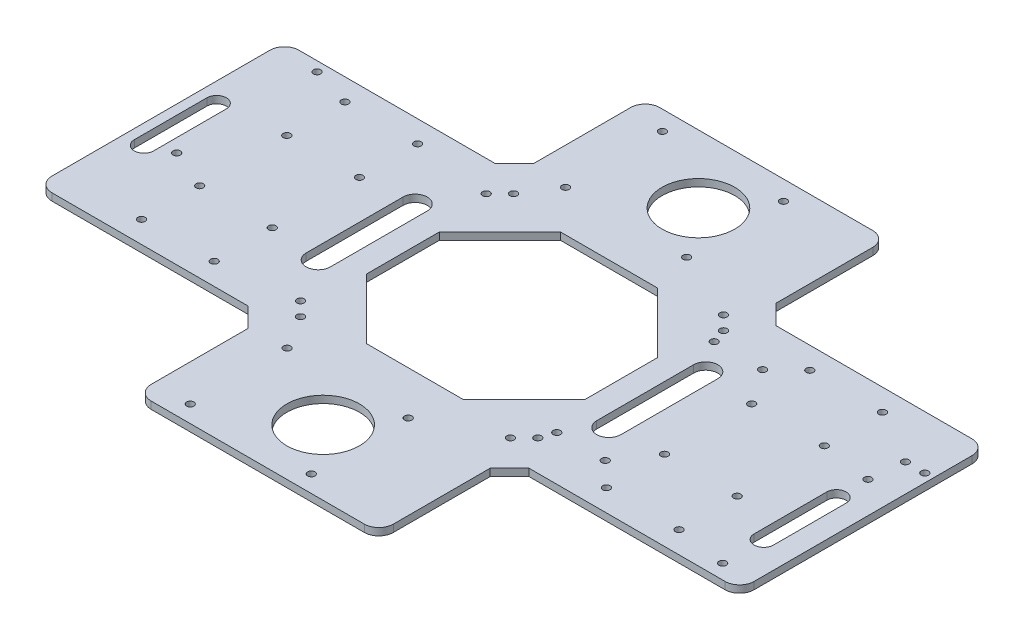
from build123d import *

# Parameters (mm, degrees)
EXTRUDE_1_DEPTH     = 3
SKETCH_2_R          = 1.5
CUT_EXTRUDE_1_DEPTH = 3
SKETCH_3_R          = 15
SKETCH_3_R_2        = 1.5
CUT_EXTRUDE_2_DEPTH = 10
SKETCH_4_W          = 90
SKETCH_4_H          = 80
CUT_EXTRUDE_3_DEPTH = 3
FILLET_3_R          = 6
CHAMFER_1_SIZE      = 8
SKETCH_7_R          = 1.5
CUT_EXTRUDE_6_DEPTH = 10
CHAMFER_2_SIZE      = 25
SKETCH_8_R          = 1.5
CUT_EXTRUDE_7_DEPTH = 10
SKETCH_9_R          = 1.5
CUT_EXTRUDE_8_DEPTH = 10


with BuildPart() as part:
    # 草图1 → 凸台-拉伸1 (new body)
    with BuildSketch(Plane(origin=(0, 0, 0), x_dir=(1, 0, 0), z_dir=(0, 1, 0))):
        Polygon((-50, -51), (-50, -105), (50, -105), (50, -51), (145, -51), (145, 51), (50, 51), (50, 105), (-50, 105), (-50, 51), (-145, 51), (-145, -51), align=None)
    extrude(amount=EXTRUDE_1_DEPTH)

    # 草图2 → 切除-拉伸1 (cut)
    with BuildSketch(Plane(origin=(0, 3, 0), x_dir=(1, 0, 0), z_dir=(0, 1, 0))):
        with Locations(Location((111, 42, 0), (0, 0, 270))):
            Circle(SKETCH_2_R)
        with Locations(Location((81, 42, 0), (0, 0, 270))):
            Circle(SKETCH_2_R)
        with Locations(Location((81, 18, 0), (0, 0, 270))):
            Circle(SKETCH_2_R)
        with Locations(Location((111, 18, 0), (0, 0, 270))):
            Circle(SKETCH_2_R)
        with Locations(Location((111, -18, 0), (0, 0, 90))):
            Circle(SKETCH_2_R)
        with Locations(Location((111, -42, 0), (0, 0, 90))):
            Circle(SKETCH_2_R)
        with Locations(Location((81, -18, 0), (0, 0, 90))):
            Circle(SKETCH_2_R)
        with Locations(Location((81, -42, 0), (0, 0, 90))):
            Circle(SKETCH_2_R)
        with Locations(Location((-81, -42, 0), (0, 0, 270))):
            Circle(SKETCH_2_R)
        with Locations(Location((-81, -18, 0), (0, 0, 270))):
            Circle(SKETCH_2_R)
        with Locations(Location((-111, -42, 0), (0, 0, 270))):
            Circle(SKETCH_2_R)
        with Locations(Location((-111, -18, 0), (0, 0, 270))):
            Circle(SKETCH_2_R)
        with Locations(Location((-111, 18, 0), (0, 0, 90))):
            Circle(SKETCH_2_R)
        with Locations(Location((-81, 18, 0), (0, 0, 90))):
            Circle(SKETCH_2_R)
        with Locations(Location((-81, 42, 0), (0, 0, 90))):
            Circle(SKETCH_2_R)
        with Locations(Location((-111, 42, 0), (0, 0, 90))):
            Circle(SKETCH_2_R)
    extrude(amount=-CUT_EXTRUDE_1_DEPTH, mode=Mode.SUBTRACT)

    # 草图3 → 切除-拉伸2 (cut)
    with BuildSketch(Plane(origin=(0, 3, 0), x_dir=(1, 0, 0), z_dir=(0, 1, 0))):
        with Locations(Location((0, 77, 0), (0, 0, 270))):
            Circle(SKETCH_3_R)
        with Locations(Location((0, -78, 0), (0, 0, 270))):
            Circle(SKETCH_3_R)
        with Locations(Location((15.11, -58, 0), (0, 0, 270))):
            Circle(SKETCH_3_R_2)
        with Locations(Location((15.11, -98, 0), (0, 0, 270))):
            Circle(SKETCH_3_R_2)
        with Locations(Location((-34.89, -98, 0), (0, 0, 270))):
            Circle(SKETCH_3_R_2)
        with Locations(Location((-34.89, -58, 0), (0, 0, 270))):
            Circle(SKETCH_3_R_2)
        with Locations(Location((15.11, 97, 0), (0, 0, 270))):
            Circle(SKETCH_3_R_2)
        with Locations(Location((15.11, 57, 0), (0, 0, 270))):
            Circle(SKETCH_3_R_2)
        with Locations(Location((-34.89, 57, 0), (0, 0, 270))):
            Circle(SKETCH_3_R_2)
        with Locations(Location((-34.89, 97, 0), (0, 0, 270))):
            Circle(SKETCH_3_R_2)
    extrude(amount=-CUT_EXTRUDE_2_DEPTH, mode=Mode.SUBTRACT)

    # 草图4 → 切除-拉伸3 (cut)
    with BuildSketch(Plane(origin=(0, 3, 0), x_dir=(1, 0, 0), z_dir=(0, 1, 0))):
        Rectangle(SKETCH_4_W, SKETCH_4_H)
    extrude(amount=-CUT_EXTRUDE_3_DEPTH, mode=Mode.SUBTRACT)

    # 圆角3
    fillet_3_edges = [part.edges().sort_by_distance(p)[0] for p in [
        (-145, 1.5, 51),
        (-145, 1.5, -51),
        (-50, 1.5, -105),
        (50, 1.5, -105),
        (145, 1.5, -51),
        (145, 1.5, 51),
        (50, 1.5, 105),
        (-50, 1.5, 105),
    ]]
    fillet(fillet_3_edges, radius=FILLET_3_R)

    # 倒角1
    chamfer_1_edges = [part.edges().sort_by_distance(p)[0] for p in [
        (-50, 1.5, 51),
        (-50, 1.5, -51),
        (50, 1.5, -51),
        (50, 1.5, 51),
    ]]
    chamfer(chamfer_1_edges, length=CHAMFER_1_SIZE)

    # 草图7 → 切除-拉伸6 (cut)
    with BuildSketch(Plane(origin=(0, 3, 0), x_dir=(1, 0, 0), z_dir=(0, 1, 0))):
        with Locations(Location((141.5, 29, 0), (0, 0, 270))):
            Circle(SKETCH_7_R)
        with Locations(Location((133.5, 29, 0), (0, 0, 270))):
            Circle(SKETCH_7_R)
        with Locations(Location((132, 15, 0), (0, 0, 270))):
            Circle(SKETCH_7_R)
        with Locations(Location((132, -45, 0), (0, 0, 270))):
            Circle(SKETCH_7_R)
        with Locations(Location((51, 32.5, 0), (0, 0, 270))):
            Circle(SKETCH_7_R)
        with Locations(Location((51, -32.5, 0), (0, 0, 270))):
            Circle(SKETCH_7_R)
        with Locations(Location((71, 32.5, 0), (0, 0, 270))):
            Circle(SKETCH_7_R)
        with Locations(Location((71, -32.5, 0), (0, 0, 270))):
            Circle(SKETCH_7_R)
        with BuildLine():
            Line((-65, -20), (-65, 20))
            ThreePointArc((-65, 20), (-60, 25), (-55, 20))
            Line((-55, 20), (-55, -20))
            ThreePointArc((-55, -20), (-60, -25), (-65, -20))
        make_face()
        with BuildLine():
            Line((65, -20), (65, 20))
            ThreePointArc((65, 20), (60, 25), (55, 20))
            Line((55, 20), (55, -20))
            ThreePointArc((55, -20), (60, -25), (65, -20))
        make_face()
        with BuildLine():
            Line((-141, -15), (-141, 15))
            ThreePointArc((-141, 15), (-137, 19), (-133, 15))
            Line((-133, 15), (-133, -15))
            ThreePointArc((-133, -15), (-137, -19), (-141, -15))
        make_face()
        with BuildLine():
            Line((128, -28), (128, 2))
            ThreePointArc((128, 2), (132, 6), (136, 2))
            Line((136, 2), (136, -28))
            ThreePointArc((136, -28), (132, -32), (128, -28))
        make_face()
    extrude(amount=-CUT_EXTRUDE_6_DEPTH, mode=Mode.SUBTRACT)

    # 倒角2
    chamfer_2_edges = [part.edges().sort_by_distance(p)[0] for p in [
        (45, 1.5, -40),
        (45, 1.5, 40),
        (-45, 1.5, 40),
        (-45, 1.5, -40),
    ]]
    chamfer(chamfer_2_edges, length=CHAMFER_2_SIZE)

    # 草图8 → 切除-拉伸7 (cut)
    with BuildSketch(Plane(origin=(0, 3, 0), x_dir=(1, 0, 0), z_dir=(0, 1, 0))):
        with Locations(Location((-127.5, 47, 0), (0, 0, 270))):
            Circle(SKETCH_8_R)
        with Locations(Location((-127.5, -11, 0), (0, 0, 270))):
            Circle(SKETCH_8_R)
    extrude(amount=-CUT_EXTRUDE_7_DEPTH, mode=Mode.SUBTRACT)

    # 草图9 → 切除-拉伸8 (cut)
    with BuildSketch(Plane(origin=(0, 3, 0), x_dir=(1, 0, 0), z_dir=(0, 1, 0))):
        with Locations(Location((43.343145751, 44, 0), (0, 0, 270))):
            Circle(SKETCH_9_R)
        with Locations(Location((49, 38.343145751, 0), (0, 0, 270))):
            Circle(SKETCH_9_R)
        with Locations(Location((49, -38.343145751, 0), (0, 0, 270))):
            Circle(SKETCH_9_R)
        with Locations(Location((43.343145751, -44, 0), (0, 0, 270))):
            Circle(SKETCH_9_R)
        with Locations(Location((-43.343145751, -44, 0), (0, 0, 270))):
            Circle(SKETCH_9_R)
        with Locations(Location((-49, -38.343145751, 0), (0, 0, 270))):
            Circle(SKETCH_9_R)
        with Locations(Location((-49, 38.343145751, 0), (0, 0, 270))):
            Circle(SKETCH_9_R)
        with Locations(Location((-43.343145751, 44, 0), (0, 0, 270))):
            Circle(SKETCH_9_R)
    extrude(amount=-CUT_EXTRUDE_8_DEPTH, mode=Mode.SUBTRACT)


solid = part.part
